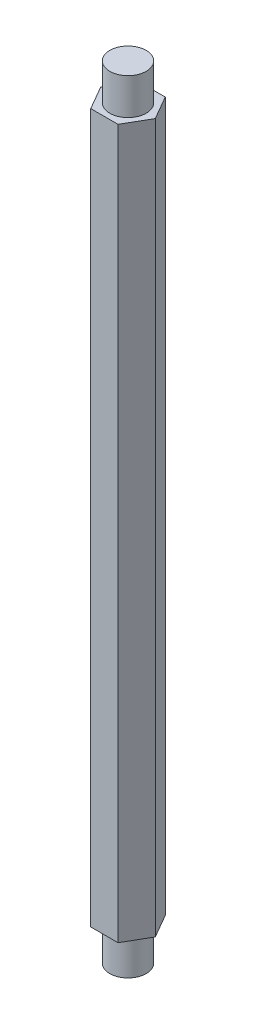
from build123d import *

# Parameters (mm, degrees)
SKETCH_1_R      = 1
EXTRUDE_1_DEPTH = 2
EXTRUDE_2_DEPTH = 39
SKETCH_3_R      = 1
EXTRUDE_3_DEPTH = 2


with BuildPart() as part:
    # 草图1 → 凸台-拉伸1 (new body)
    with BuildSketch(Plane(origin=(0, 0, 0), x_dir=(1, 0, 0), z_dir=(0, 1, 0))):
        with Locations(Location((0, 0, 0), (0, 0, 270))):
            Circle(SKETCH_1_R)
    extrude(amount=EXTRUDE_1_DEPTH)

    # 草图2 → 凸台-拉伸2 (add)
    with BuildSketch(Plane(origin=(0, 2, 0), x_dir=(1, 0, 0), z_dir=(0, 1, 0))):
        Polygon((1.5011107, 0), (0.75055535, 1.3), (-0.75055535, 1.3), (-1.5011107, 0), (-0.75055535, -1.3), (0.75055535, -1.3), align=None)
    extrude(amount=EXTRUDE_2_DEPTH)

    # 草图3 → 凸台-拉伸3 (add)
    with BuildSketch(Plane(origin=(0, 41, 0), x_dir=(1, 0, 0), z_dir=(0, 1, 0))):
        with Locations(Location((0, 0, 0), (0, 0, 270))):
            Circle(SKETCH_3_R)
    extrude(amount=EXTRUDE_3_DEPTH)


solid = part.part
